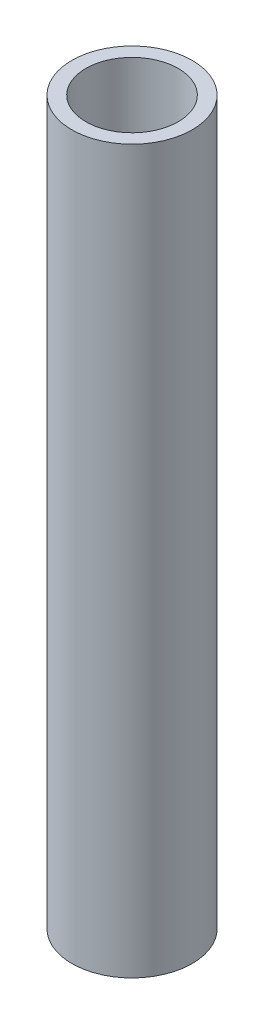
from build123d import *

# Parameters (mm, degrees)
SKETCH2_R           = 6.35
SKETCH2_R_2         = 4.8768
BOSS_EXTRUDE1_DEPTH = 38.1


with BuildPart() as part:
    # Sketch2 → Boss-Extrude1 (new, symmetric)
    with BuildSketch(Plane(origin=(0, 0, 0), x_dir=(1, 0, 0), z_dir=(0, 1, 0))):
        with Locations(Location((0, 0, 0), (0, 0, 90))):
            Circle(SKETCH2_R)
        with Locations(Location((0, 0, 0), (0, 0, 90))):
            Circle(SKETCH2_R_2, mode=Mode.SUBTRACT)
    extrude(amount=BOSS_EXTRUDE1_DEPTH, both=True)


solid = part.part
